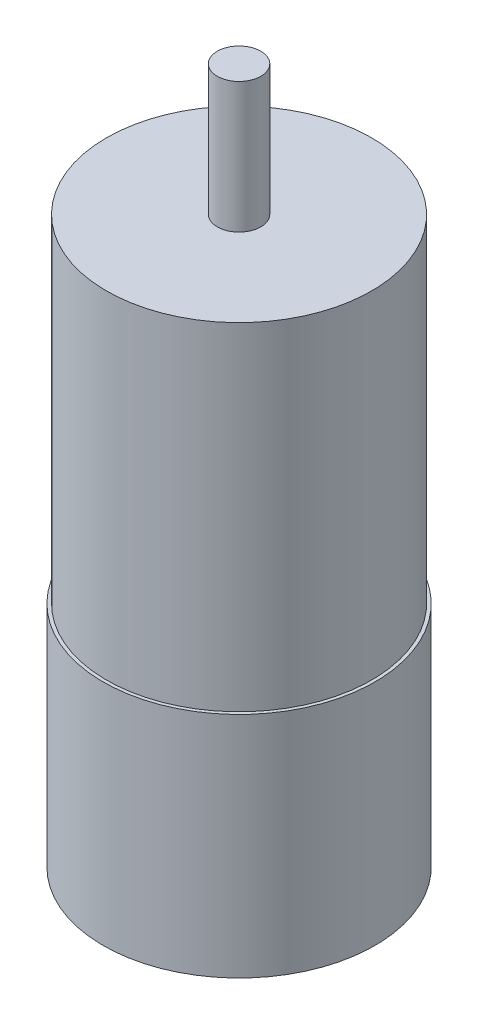
from build123d import *

# Parameters (mm, degrees)
ESQUISSE2_W = 2
ESQUISSE2_H = 12


with BuildPart() as part:
    # Esquisse2 → Révolution2 (revolve)
    with BuildSketch(Plane.XY, mode=Mode.PRIVATE) as r_volution2_sk:
        Polygon((2, 32.533333333), (0, 32.533333333), (0, 1.533333333), (12.2, 1.533333333), (12.2, 32.533333333), align=None)
        with Locations((1, 38.533333333)):
            Rectangle(ESQUISSE2_W, ESQUISSE2_H)
        Polygon((12.2, 1.533333333), (0, 1.533333333), (0, -19.466666667), (12.5, -19.466666667), (12.5, 1.533333333), align=None)
    revolve(r_volution2_sk.sketch.rotate(Axis((0, 32.533333333, 0), (0, -1, 0)), 180), axis=Axis((0, 32.533333333, 0), (0, -1, 0)))


solid = part.part
